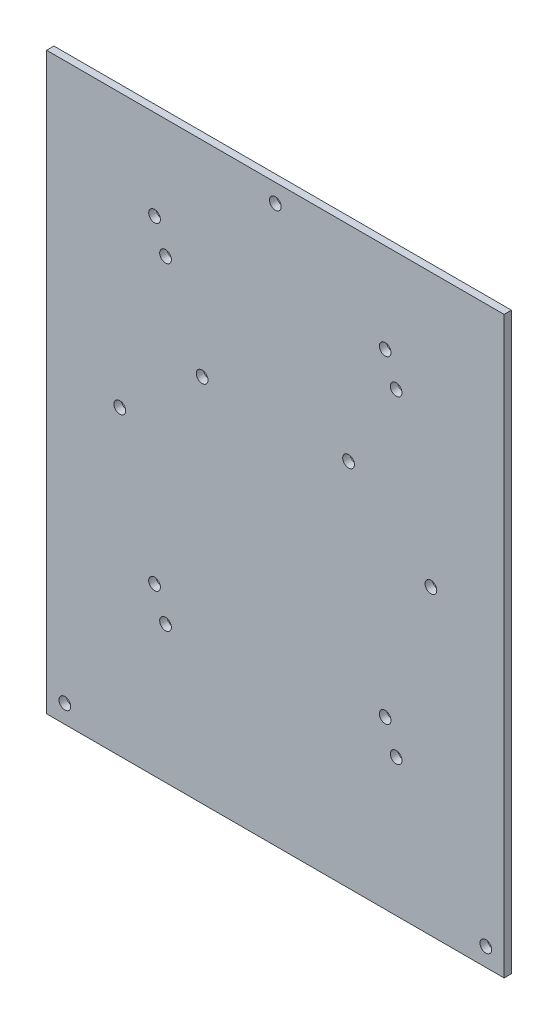
from build123d import *

# Parameters (mm, degrees)
SKETCH_1_W      = 125
SKETCH_1_H      = 157
SKETCH_1_R      = 1.6
SKETCH_1_W_2    = 10
SKETCH_1_H_2    = 15
EXTRUDE_1_DEPTH = 2


with BuildPart() as part:
    # 草圖1 → 填料-伸長1 (new body)
    # profile 1 of 5: a face of its own
    with BuildSketch(Plane.XY):
        with Locations((0, 78.5)):
            Rectangle(SKETCH_1_W, SKETCH_1_H)
        with Locations((-42.5, 82.5)):
            Circle(SKETCH_1_R, mode=Mode.SUBTRACT)
        with Locations((42.5, 82.5)):
            Circle(SKETCH_1_R, mode=Mode.SUBTRACT)
        with Locations((0, 152)):
            Circle(SKETCH_1_R, mode=Mode.SUBTRACT)
        with Locations((20, 101)):
            Circle(SKETCH_1_R, mode=Mode.SUBTRACT)
        with Locations((-20, 101)):
            Circle(SKETCH_1_R, mode=Mode.SUBTRACT)
        with Locations((57.5, 5)):
            Circle(SKETCH_1_R, mode=Mode.SUBTRACT)
        with Locations((-57.5, 5)):
            Circle(SKETCH_1_R, mode=Mode.SUBTRACT)
        with Locations((-31.5, 128.5)):
            Rectangle(SKETCH_1_W_2, SKETCH_1_H_2, mode=Mode.SUBTRACT)
        with Locations((31.5, 41.5)):
            Rectangle(SKETCH_1_W_2, SKETCH_1_H_2, mode=Mode.SUBTRACT)
        with Locations((-31.5, 41.5)):
            Rectangle(SKETCH_1_W_2, SKETCH_1_H_2, mode=Mode.SUBTRACT)
        with Locations((31.5, 128.5)):
            Rectangle(SKETCH_1_W_2, SKETCH_1_H_2, mode=Mode.SUBTRACT)
    # profile 2 of 5: a face of its own
    with BuildSketch(Plane.XY):
        with Locations((31.5, 128.5)):
            Rectangle(SKETCH_1_W_2, SKETCH_1_H_2)
        with Locations((30, 132.5)):
            Circle(SKETCH_1_R, mode=Mode.SUBTRACT)
        with Locations((33, 124.5)):
            Circle(SKETCH_1_R, mode=Mode.SUBTRACT)
    # profile 3 of 5: a face of its own
    with BuildSketch(Plane.XY):
        with Locations((-31.5, 128.5)):
            Rectangle(SKETCH_1_W_2, SKETCH_1_H_2)
        with Locations((-30, 124.5)):
            Circle(SKETCH_1_R, mode=Mode.SUBTRACT)
        with Locations((-33, 132.5)):
            Circle(SKETCH_1_R, mode=Mode.SUBTRACT)
    # profile 4 of 5: a face of its own
    with BuildSketch(Plane.XY):
        with Locations((-31.5, 41.5)):
            Rectangle(SKETCH_1_W_2, SKETCH_1_H_2)
        with Locations((-30, 37.5)):
            Circle(SKETCH_1_R, mode=Mode.SUBTRACT)
        with Locations((-33, 45.5)):
            Circle(SKETCH_1_R, mode=Mode.SUBTRACT)
    # profile 5 of 5: a face of its own
    with BuildSketch(Plane.XY):
        with Locations((31.5, 41.5)):
            Rectangle(SKETCH_1_W_2, SKETCH_1_H_2)
        with Locations((33, 37.5)):
            Circle(SKETCH_1_R, mode=Mode.SUBTRACT)
        with Locations((30, 45.5)):
            Circle(SKETCH_1_R, mode=Mode.SUBTRACT)
    extrude(amount=EXTRUDE_1_DEPTH)


solid = part.part
